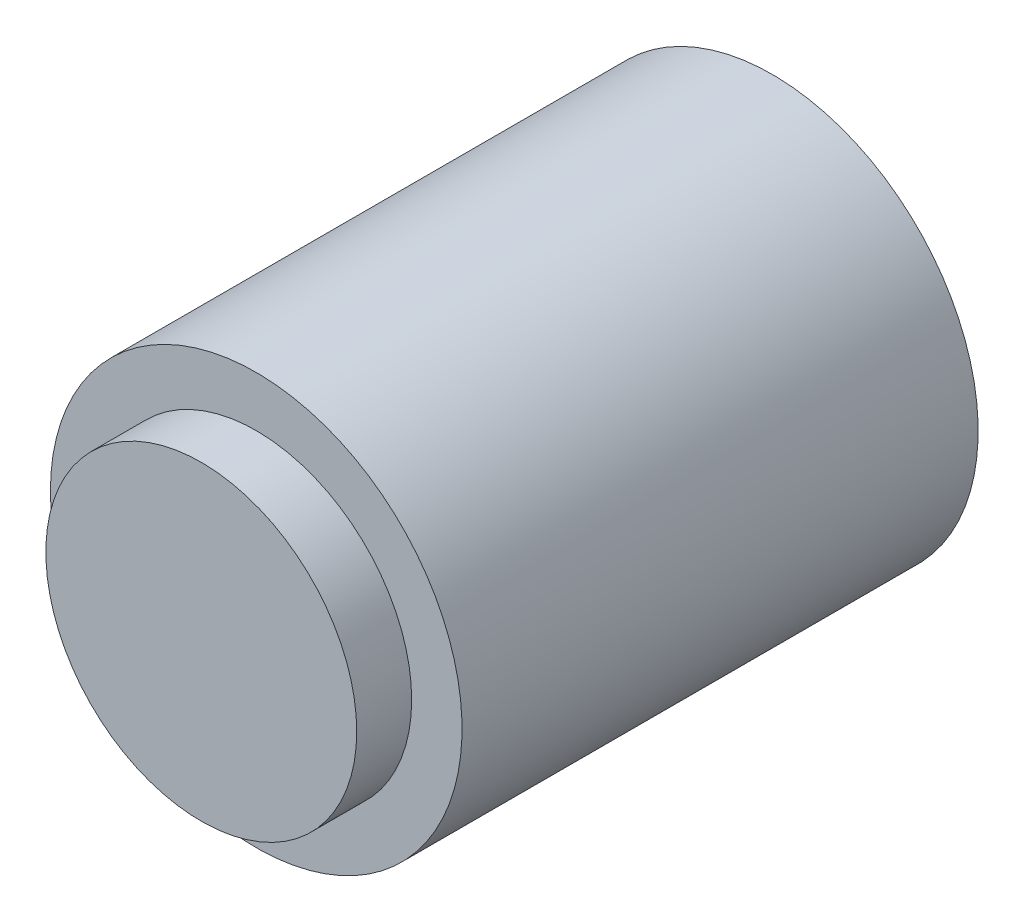
from build123d import *

# Parameters (mm, degrees)
SKETCH1_R           = 16.75
BOSS_EXTRUDE1_DEPTH = 42
SKETCH2_R           = 12.65
BOSS_EXTRUDE2_DEPTH = 4.47
SKETCH3_R           = 15.5
CUT_EXTRUDE1_DEPTH  = 4.7


with BuildPart() as part:
    # Sketch1 → Boss-Extrude1 (new body)
    with BuildSketch(Plane.XY):
        with Locations(Location((0, 0, 0), (0, 0, 180))):
            Circle(SKETCH1_R)
    extrude(amount=BOSS_EXTRUDE1_DEPTH)

    # Sketch2 → Boss-Extrude2 (add)
    with BuildSketch(Plane.XY.offset(42)):
        Circle(SKETCH2_R)
    extrude(amount=BOSS_EXTRUDE2_DEPTH)

    # Sketch3 → Cut-Extrude1 (cut)
    with BuildSketch(Plane(origin=(0, 0, 0), x_dir=(-1, 0, 0), z_dir=(0, 0, -1))):
        Circle(SKETCH3_R)
    extrude(amount=-CUT_EXTRUDE1_DEPTH, mode=Mode.SUBTRACT)


solid = part.part
